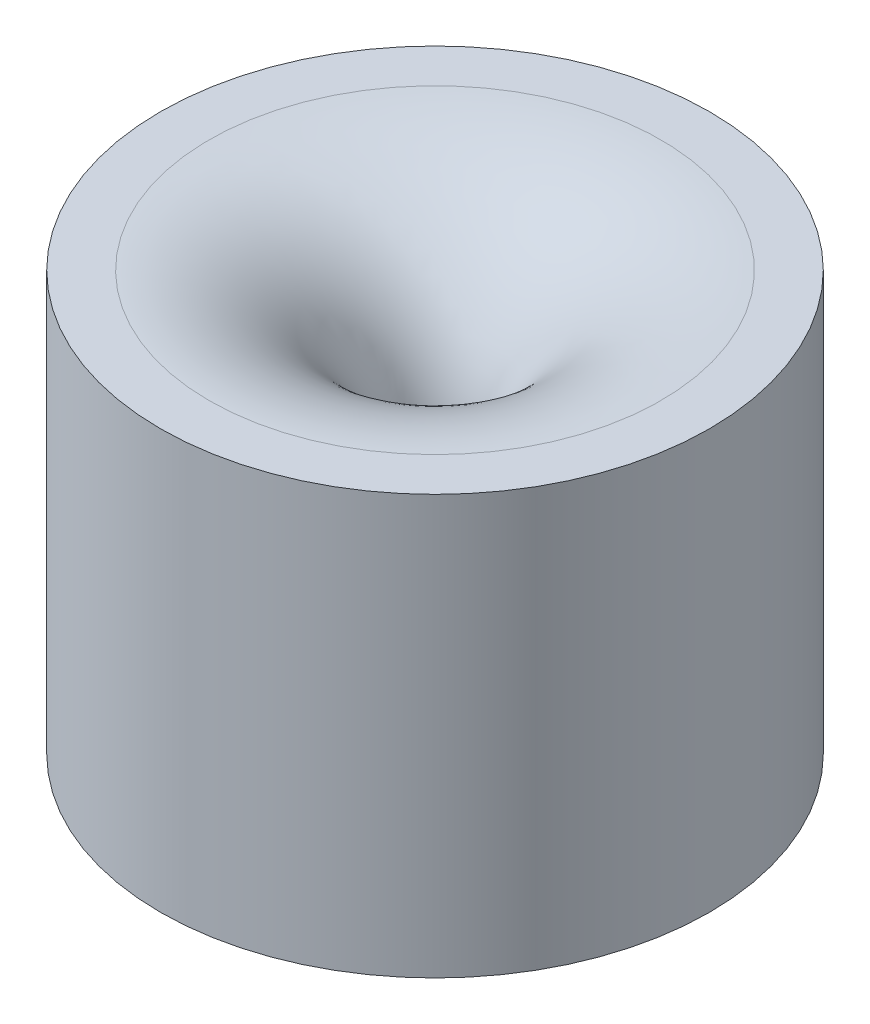
from build123d import *

# Parameters (mm, degrees)
SKETCH1_R           = 29.175
SKETCH1_R_2         = 4
BOSS_EXTRUDE1_DEPTH = 44.5
FILLET1_R           = 20


with BuildPart() as part:
    # Sketch1 → Boss-Extrude1 (new body)
    with BuildSketch(Plane(origin=(0, 0, 0), x_dir=(1, 0, 0), z_dir=(0, 1, 0))):
        with Locations(Location((0, 0, 0), (0, 0, 270))):
            Circle(SKETCH1_R)
        with Locations(Location((0, 0, 0), (0, 0, 270))):
            Circle(SKETCH1_R_2, mode=Mode.SUBTRACT)
    extrude(amount=BOSS_EXTRUDE1_DEPTH)

    # Fillet1
    fillet1_edges = [part.edges().sort_by_distance(p)[0] for p in [
        (0, 44.5, -4),
    ]]
    fillet(fillet1_edges, radius=FILLET1_R)


solid = part.part
